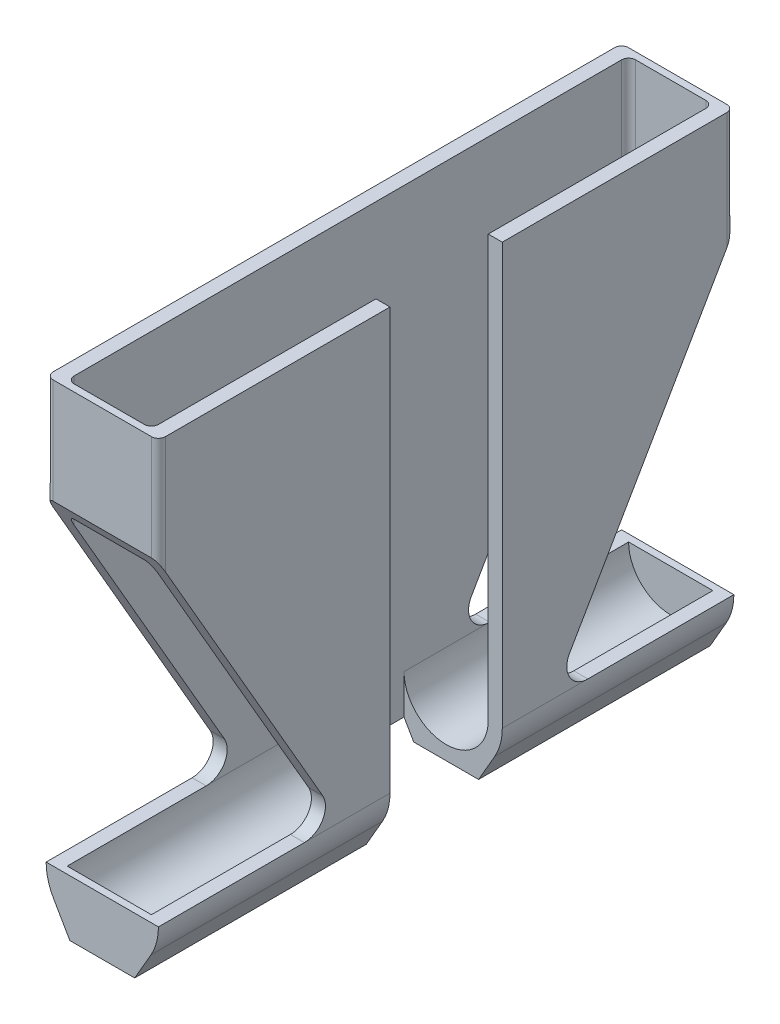
from build123d import *

# Parameters (mm, degrees)
EXTRUDE_1_DEPTH     = 40
EXTRUDE_START       = 1
EXTRUDE_2_DEPTH     = 1
CUT_EXTRUDE_7_REACH = 83
FILLET_1_R          = 3
EXTRUDE_6_DEPTH     = 41
SKETCH_2_W          = 15.763743406
SKETCH_2_H          = 16
CUT_EXTRUDE_1_DEPTH = 80
FILLET_2_R          = 1


with BuildPart() as part:
    # 草图1 → 凸台-拉伸1 (new, symmetric)
    with BuildSketch(Plane.XY):
        with BuildLine():
            Line((0, 0), (0, -60))
            ThreePointArc((0, -60), (6, -66), (12, -60))
            Line((12, -60), (12, 0))
            Line((12, 0), (14, 0))
            Line((14, 0), (14, -60))
            ThreePointArc((14, -60), (6, -68), (-2, -60))
            Line((-2, -60), (-2, 0))
            Line((-2, 0), (0, 0))
        make_face()
    extrude(amount=EXTRUDE_1_DEPTH, both=True)

    # 草图3 → 凸台-拉伸2 (add)
    with BuildSketch(Plane.XY.offset(40).offset(EXTRUDE_START)):
        with BuildLine():
            Line((14, -60), (14, 0))
            Line((14, 0), (-2, 0))
            Line((-2, 0), (-2, -60))
            ThreePointArc((-2, -60), (6, -68), (14, -60))
        make_face()
    extrude_2 = extrude(amount=-EXTRUDE_2_DEPTH)

    # 镜向1: 凸台-拉伸2 across plane
    add(extrude_2.mirror(Plane.XY))

    # 切除-拉伸7: up to this face of the body (flat: up to its plane)
    cut_extrude_7_end = Plane(part.part.faces().sort_by_distance((14, -30, 0))[0])
    # 草图4 → 切除-拉伸7 (cut, up to the picked face)
    with BuildSketch(Plane.ZY.offset(2), mode=Mode.PRIVATE) as cut_extrude_7_sk1:
        Polygon((15, -60), (41, -60), (41, -14.966679003), align=None)
    cut_extrude_7_tool1 = split(extrude(cut_extrude_7_sk1.sketch, amount=-CUT_EXTRUDE_7_REACH, mode=Mode.PRIVATE), bisect_by=cut_extrude_7_end, keep=Keep.BOTH, mode=Mode.PRIVATE)
    # 草图4 → 切除-拉伸7 (cut, up to the picked face)
    with BuildSketch(Plane.ZY.offset(2), mode=Mode.PRIVATE) as cut_extrude_7_sk2:
        Polygon((-41, -14.966679003), (-15, -60), (-41, -60), align=None)
    cut_extrude_7_tool2 = split(extrude(cut_extrude_7_sk2.sketch, amount=-CUT_EXTRUDE_7_REACH, mode=Mode.PRIVATE), bisect_by=cut_extrude_7_end, keep=Keep.BOTH, mode=Mode.PRIVATE)
    add(cut_extrude_7_tool1.solids().sort_by(Axis((-2, -44.988893, 32.333333), (1, 0, 0)))[0], mode=Mode.SUBTRACT)
    add(cut_extrude_7_tool2.solids().sort_by(Axis((-2, -44.988893, -32.333333), (1, 0, 0)))[0], mode=Mode.SUBTRACT)

    # 圆角1
    fillet_1_edges = [part.edges().sort_by_distance(p)[0] for p in [
        (13, -60, 15),
        (-1, -60, 15),
        (13, -60, -15),
        (-1, -60, -15),
    ]]
    fillet(fillet_1_edges, radius=FILLET_1_R)

    # 草图7 → 凸台-拉伸6 (add, symmetric)
    with BuildSketch(Plane.XY):
        with BuildLine():
            Line((0.255437353, -64), (-0.92820323, -64))
            Line((-0.92820323, -64), (1.381197846, -68))
            Line((1.381197846, -68), (2.144974753, -68))
            Line((2.144974753, -68), (9.855025247, -68))
            Line((9.855025247, -68), (10.618802154, -68))
            Line((10.618802154, -68), (12.92820323, -64))
            Line((12.92820323, -64), (11.744562647, -64))
            ThreePointArc((11.744562647, -64), (6, -67), (0.255437353, -64))
        make_face()
    extrude(amount=EXTRUDE_6_DEPTH, both=True)

    # 草图2 → 切除-拉伸1 (cut)
    with BuildSketch(Plane(origin=(0, 0, 0), x_dir=(1, 0, 0), z_dir=(0, 1, 0))):
        with Locations((7.881871703, 0)):
            Rectangle(SKETCH_2_W, SKETCH_2_H)
    extrude(amount=-CUT_EXTRUDE_1_DEPTH, mode=Mode.SUBTRACT)

    # 圆角2
    fillet_2_edges = [part.edges().sort_by_distance(p)[0] for p in [
        (12, -8.349364905, 40),
        (-2, -7.483339502, 41),
        (-2, -7.483339502, -41),
        (0, -8.349364905, -40),
        (14, -7.483339502, -41),
        (14, -7.483339502, 41),
        (0, -8.349364905, 40),
        (12, -8.349364905, -40),
    ]]
    fillet(fillet_2_edges, radius=FILLET_2_R)


solid = part.part
